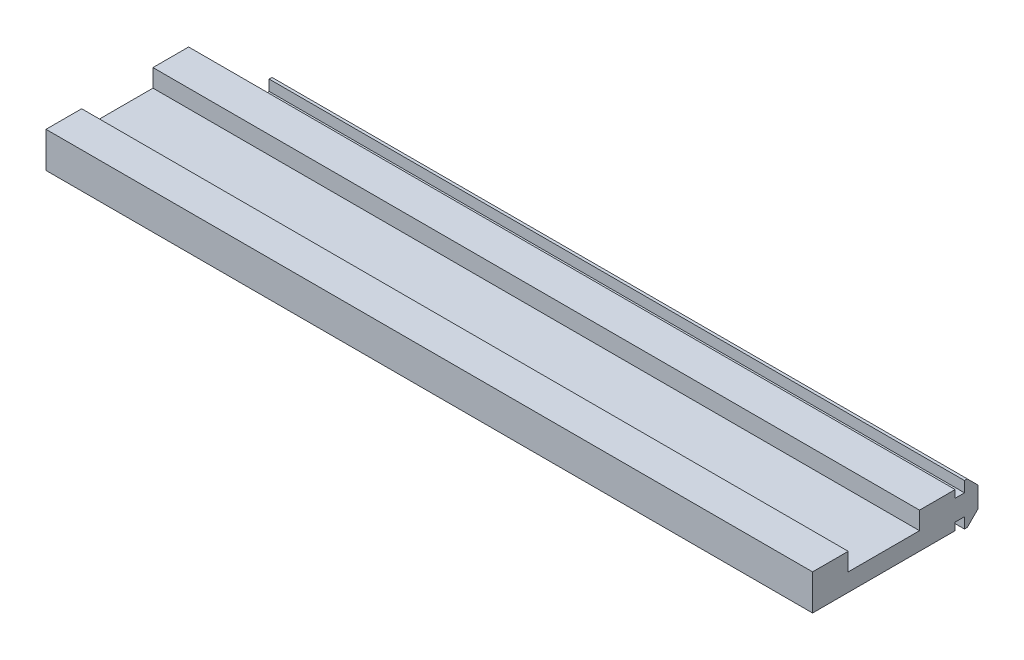
from build123d import *

# Parameters (mm, degrees)
SKETCH1_R           = 2.1
BOSS_EXTRUDE1_DEPTH = 65
SKETCH84_W          = 0.3
SKETCH84_H          = 5.4
BOSS_EXTRUDE6_DEPTH = 430
SKETCH85_W          = 26.589814492
SKETCH85_H          = 26.977421118
CUT_EXTRUDE59_DEPTH = 434.070721707
SKETCH86_W          = 10.5
SKETCH86_H          = 16.670499862
CUT_EXTRUDE60_DEPTH = 20
SKETCH88_W          = 63.871976351
SKETCH88_H          = 27.184970046
CUT_EXTRUDE62_DEPTH = 215
BOSS_EXTRUDE7_DEPTH = 195


with BuildPart() as part:
    # Sketch1 → Boss-Extrude1 (new body)
    with BuildSketch(Plane(origin=(0, 0, 0), x_dir=(0, 0, -1), z_dir=(1, 0, 0))):
        with BuildLine():
            Line((-10, 9), (-10, 3))
            Line((-10, 3), (-8, 3))
            Line((-8, 3), (-8, 6))
            Line((-8, 6), (-7.060660172, 6))
            Line((-7.060660172, 6), (-4, 2.939339828))
            Line((-4, 2.939339828), (-4, -2.939339828))
            Line((-4, -2.939339828), (-7.060660172, -6))
            Line((-7.060660172, -6), (-8, -6))
            Line((-8, -6), (-8, -3))
            Line((-8, -3), (-10, -3))
            Line((-10, -3), (-10, -9))
            ThreePointArc((-10, -9), (-9.707106781, -9.707106781), (-9, -10))
            Line((-9, -10), (-3, -10))
            Line((-3, -10), (-3, -8))
            Line((-3, -8), (-6, -8))
            Line((-6, -8), (-6, -7.060660172))
            Line((-6, -7.060660172), (-2.939339828, -4))
            Line((-2.939339828, -4), (2.939339828, -4))
            Line((2.939339828, -4), (6, -7.060660172))
            Line((6, -7.060660172), (6, -8))
            Line((6, -8), (3, -8))
            Line((3, -8), (3, -10))
            Line((3, -10), (9, -10))
            ThreePointArc((9, -10), (9.707106781, -9.707106781), (10, -9))
            Line((10, -9), (10, -3))
            Line((10, -3), (8, -3))
            Line((8, -3), (8, -6))
            Line((8, -6), (7.060660172, -6))
            Line((7.060660172, -6), (4, -2.939339828))
            Line((4, -2.939339828), (4, 2.939339828))
            Line((4, 2.939339828), (7.060660172, 6))
            Line((7.060660172, 6), (8, 6))
            Line((8, 6), (8, 3))
            Line((8, 3), (10, 3))
            Line((10, 3), (10, 9))
            ThreePointArc((10, 9), (9.707106781, 9.707106781), (9, 10))
            Line((9, 10), (3, 10))
            Line((3, 10), (3, 8))
            Line((3, 8), (6, 8))
            Line((6, 8), (6, 7.060660172))
            Line((6, 7.060660172), (2.939339828, 4))
            Line((2.939339828, 4), (-2.939339828, 4))
            Line((-2.939339828, 4), (-6, 7.060660172))
            Line((-6, 7.060660172), (-6, 8))
            Line((-6, 8), (-3, 8))
            Line((-3, 8), (-3, 10))
            Line((-3, 10), (-9, 10))
            ThreePointArc((-9, 10), (-9.707106781, 9.707106781), (-10, 9))
        make_face()
        Circle(SKETCH1_R, mode=Mode.SUBTRACT)
    extrude(amount=BOSS_EXTRUDE1_DEPTH)

    # Sketch85 → Cut-Extrude59 (cut, through all)
    with BuildSketch(Plane(origin=(65, 0, 0), x_dir=(0, 0, -1), z_dir=(1, 0, 0))):
        with Locations((1.176321583, -0.814927094)):
            Rectangle(SKETCH85_W, SKETCH85_H)
    extrude(amount=-CUT_EXTRUDE59_DEPTH, mode=Mode.SUBTRACT)


with BuildPart() as body_2:
    # Sketch84 → Boss-Extrude6 (new body)
    with BuildSketch(Plane(origin=(65, 0, 0), x_dir=(0, 0, -1), z_dir=(1, 0, 0))):
        Polygon((-10, -2.7), (-10, 2.7), (-10.5, 2.7), (-10.5, 5), (-20.5, 5), (-20.5, 0), (-40.5, 0), (-40.5, 5), (-50.5, 5), (-50.5, -5), (-10.5, -5), (-10.5, -2.7), align=None)
        Polygon((-7.18492424, 5.7), (-4.3, 2.81507576), (-4.3, -2.81507576), (-7.18492424, -5.7), (-7.7, -5.7), (-7.7, -2.7), (-9.7, -2.7), (-9.7, 2.7), (-7.7, 2.7), (-7.7, 5.7), align=None)
        with Locations((-9.85, 0)):
            Rectangle(SKETCH84_W, SKETCH84_H)
    extrude(amount=BOSS_EXTRUDE6_DEPTH)

    # Sketch86 → Cut-Extrude60 (cut)
    with BuildSketch(Plane.ZY.offset(-65)):
        with Locations((5.25, -0.117074477)):
            Rectangle(SKETCH86_W, SKETCH86_H)
    extrude(amount=-CUT_EXTRUDE60_DEPTH, mode=Mode.SUBTRACT)

    # Sketch88 → Cut-Extrude62 (cut)
    with BuildSketch(Plane(origin=(495, 0, 0), x_dir=(0, 0, -1), z_dir=(1, 0, 0))):
        with Locations((-29.280082041, 0.441796331)):
            Rectangle(SKETCH88_W, SKETCH88_H)
    extrude(amount=-CUT_EXTRUDE62_DEPTH, mode=Mode.SUBTRACT)

    # Sketch89 → Boss-Extrude7 (add)
    with BuildSketch(Plane(origin=(280, 0, 0), x_dir=(0, 0, -1), z_dir=(1, 0, 0))):
        Polygon((-10.7, 2.9), (-10.7, -2.9), (-7.9, -2.9), (-7.9, -5.9), (-7.102081528, -5.9), (-4.1, -2.897918472), (-4.1, 2.897918472), (-7.102081528, 5.9), (-7.9, 5.9), (-7.9, 2.9), align=None)
        Polygon((-10.5, 2.7), (-10.5, -2.7), (-7.7, -2.7), (-7.7, -5.7), (-7.18492424, -5.7), (-4.3, -2.81507576), (-4.3, 2.81507576), (-7.18492424, 5.7), (-7.7, 5.7), (-7.7, 2.7), align=None, mode=Mode.SUBTRACT)
    extrude(amount=-BOSS_EXTRUDE7_DEPTH)


solid = body_2.part
